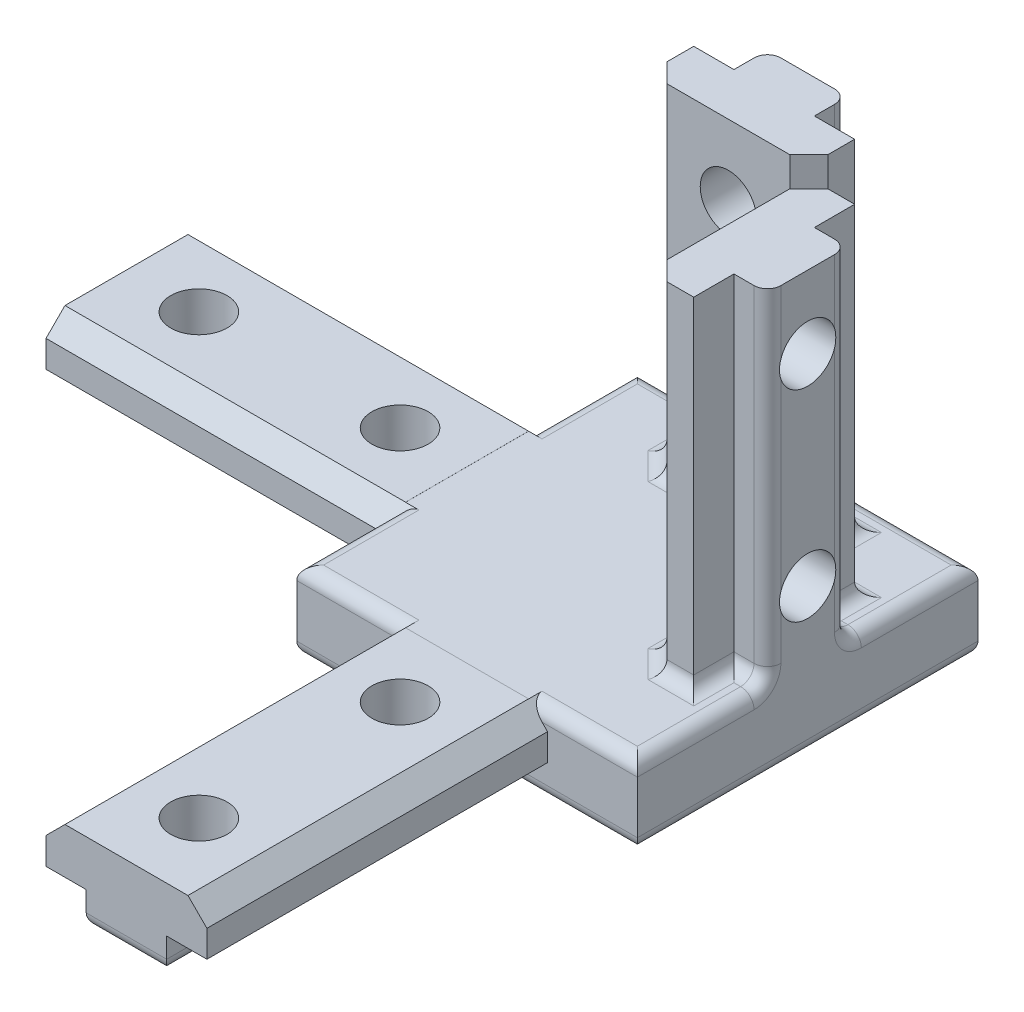
from build123d import *

# Parameters (mm, degrees)
SKETCH1_W             = 25.4
SKETCH1_H             = 25.4
BOSS_EXTRUDE1_DEPTH   = 5.91
BOSS_EXTRUDE2_DEPTH   = 25.4
BOSS_EXTRUDE3_DEPTH   = 25.4
BOSS_EXTRUDE4_DEPTH   = 25.4
FILLET2_R             = 1
M5X0_8_TAPPED_HOLE2_D = 4.2
M5X0_8_TAPPED_HOLE3_D = 4.2
M5X0_8_TAPPED_HOLE4_D = 4.2


with BuildPart() as part:
    # Sketch1 → Boss-Extrude1 (new body)
    with BuildSketch(Plane(origin=(0, 0, 0), x_dir=(1, 0, 0), z_dir=(0, 1, 0))):
        Rectangle(SKETCH1_W, SKETCH1_H)
    extrude(amount=BOSS_EXTRUDE1_DEPTH)

    # Sketch2 → Boss-Extrude2 (add)
    with BuildSketch(Plane.XY.offset(12.7)):
        Polygon((-3, 0), (3, 0), (3, 2.5), (6, 2.5), (6, 4.5), (4.585786438, 5.914213562), (-4.585786438, 5.914213562), (-6, 4.5), (-6, 2.5), (-3, 2.5), align=None)
    extrude(amount=BOSS_EXTRUDE2_DEPTH)

    # Sketch3 → Boss-Extrude3 (add)
    with BuildSketch(Plane.ZY.offset(12.7)):
        Polygon((-3, 0), (3, 0), (3, 2.5), (6, 2.5), (6, 4.5), (4.585786438, 5.914213562), (-4.585786438, 5.914213562), (-6, 4.5), (-6, 2.5), (-3, 2.5), align=None)
    extrude(amount=BOSS_EXTRUDE3_DEPTH)

    # Sketch5 → Boss-Extrude4 (add)
    with BuildSketch(Plane(origin=(0, 5.91, 0), x_dir=(1, 0, 0), z_dir=(0, 1, 0))):
        Polygon((3, 12.7), (-3, 12.7), (-3, 10.2), (-6, 10.2), (-6, 8.2), (-4.585786438, 6.785786438), (4.585786438, 6.785786438), (6, 8.2), (6, 10.2), (3, 10.2), align=None)
        Polygon((12.7, -3), (12.7, 3), (10.2, 3), (10.2, 6), (8.2, 6), (6.785786438, 4.585786438), (6.785786438, -4.585786438), (8.2, -6), (10.2, -6), (10.2, -3), align=None)
    extrude(amount=BOSS_EXTRUDE4_DEPTH)

    # Fillet2
    fillet2_edges = [part.edges().sort_by_distance(p)[0] for p in [
        (7.492893219, 5.91, -5.292893219),
        (6.785786438, 5.91, 0),
        (7.492893219, 5.91, 5.292893219),
        (9.2, 5.91, 6),
        (10.2, 5.91, 4.5),
        (11.45, 5.91, 3),
        (12.7, 18.61, 3),
        (-12.7, 5.91, -8.645),
        (7.85, 0, 12.7),
        (8.645, 5.91, 12.7),
        (-8.645, 5.91, 12.7),
        (3, 0, 25.4),
        (-3, 0, 25.4),
        (0, 0, 38.1),
        (-12.7, 0, 7.85),
        (-12.7, 5.91, 8.645),
        (-25.4, 0, 3),
        (12.7, 5.91, 7.85),
        (-7.85, 0, 12.7),
        (-12.7, 0, -7.85),
        (-25.4, 0, -3),
        (-38.1, 0, 0),
        (0, 0, -12.7),
        (12.7, 0, 0),
        (12.7, 5.91, -7.85),
        (-7.85, 5.91, -12.7),
        (-3, 5.91, -11.45),
        (-3, 18.61, -12.7),
        (-4.5, 5.91, -10.2),
        (-6, 5.91, -9.2),
        (-5.292893219, 5.91, -7.492893219),
        (0, 5.91, -6.785786438),
        (5.292893219, 5.91, -7.492893219),
        (6, 5.91, -9.2),
        (4.5, 5.91, -10.2),
        (3, 5.91, -11.45),
        (3, 18.61, -12.7),
        (7.85, 5.91, -12.7),
        (11.45, 5.91, -3),
        (12.7, 18.61, -3),
        (10.2, 5.91, -4.5),
        (9.2, 5.91, -6),
    ]]
    fillet(fillet2_edges, radius=FILLET2_R)

    # M5x0.8 Tapped Hole2 (through all)
    with Locations(Plane(origin=(0, 0, 0), x_dir=(-1, 0, 0), z_dir=(0, -1, 0))):
        with Locations((0, -17.7), (0, -32.7), (17.7, 0), (32.7, 0)):
            Hole(M5X0_8_TAPPED_HOLE2_D / 2)

    # M5x0.8 Tapped Hole3 (through all)
    with Locations(Plane(origin=(12.7, 0, 0), x_dir=(0, 0, -1), z_dir=(1, 0, 0))):
        with Locations((0, 10.91), (0, 25.91)):
            Hole(M5X0_8_TAPPED_HOLE3_D / 2)

    # M5x0.8 Tapped Hole4 (through all)
    with Locations(Plane(origin=(0, 0, -12.7), x_dir=(-1, 0, 0), z_dir=(0, 0, -1))):
        with Locations((0, 25.91), (0, 10.91)):
            Hole(M5X0_8_TAPPED_HOLE4_D / 2)


solid = part.part
